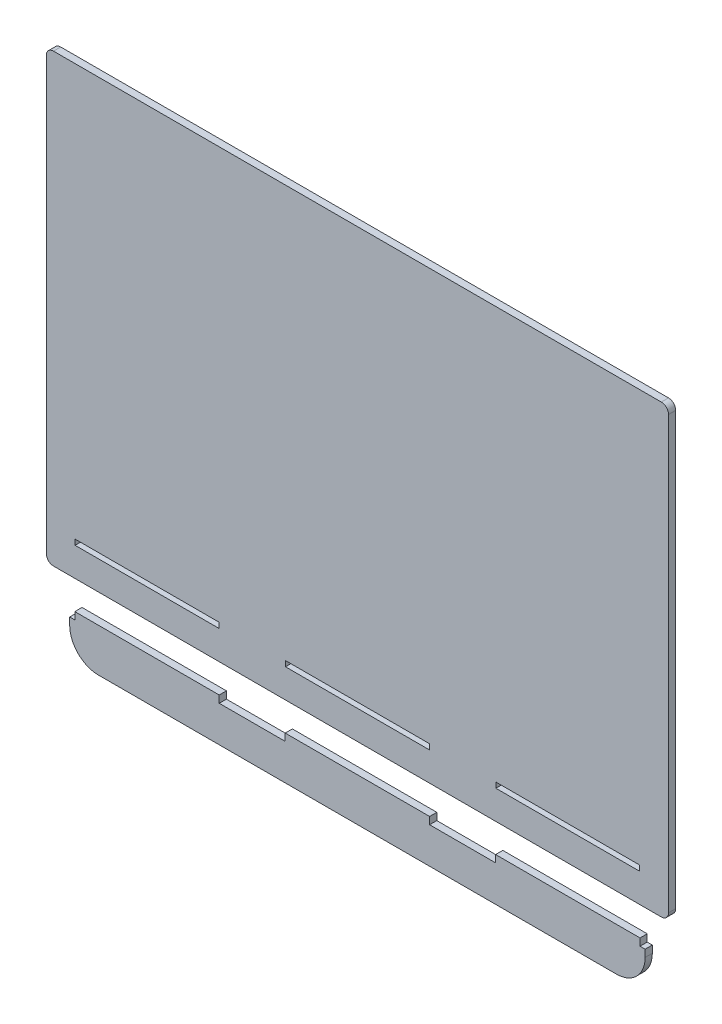
from build123d import *

# Parameters (mm, degrees)
BOSS_EXTRUDE1_DEPTH = 6.35
SKETCH2_W           = 127
SKETCH2_H           = 4.7625
CUT_EXTRUDE1_DEPTH  = 676.827668955
SKETCH3_W           = 508
SKETCH3_H           = 6.35
BOSS_EXTRUDE2_DEPTH = 38.1
SKETCH8_W           = 4.5085
SKETCH8_H           = 6.35
SKETCH8_W_2         = 58.2295
CUT_EXTRUDE2_DEPTH  = 676.827668955
FILLET1_R           = 25.4


with BuildPart() as part:
    # Sketch1 → Boss-Extrude1 (new body)
    with BuildSketch(Plane.XY):
        with BuildLine():
            Line((6.35, 0), (542.925, 0))
            ThreePointArc((542.925, 0), (547.415128061, 1.859871939), (549.275, 6.35))
            Line((549.275, 6.35), (549.275, 387.35))
            ThreePointArc((549.275, 387.35), (547.415128061, 391.840128061), (542.925, 393.7))
            Line((542.925, 393.7), (6.35, 393.7))
            ThreePointArc((6.35, 393.7), (1.859871939, 391.840128061), (0, 387.35))
            Line((0, 387.35), (0, 6.35))
            ThreePointArc((0, 6.35), (1.859871939, 1.859871939), (6.35, 0))
        make_face()
    extrude(amount=BOSS_EXTRUDE1_DEPTH)

    # Sketch2 → Cut-Extrude1 (cut, through all)
    with BuildSketch(Plane.XY.offset(6.35)):
        with Locations((460.375, 27.78125)):
            Rectangle(SKETCH2_W, SKETCH2_H)
        with Locations((274.6375, 27.78125)):
            Rectangle(SKETCH2_W, SKETCH2_H)
        with Locations((88.9, 27.78125)):
            Rectangle(SKETCH2_W, SKETCH2_H)
    extrude(amount=-CUT_EXTRUDE1_DEPTH, mode=Mode.SUBTRACT)


with BuildPart() as body_2:
    # Sketch3 → Boss-Extrude2 (new body)
    with BuildSketch(Plane.XZ.offset(25.4)):
        with Locations((274.6375, 3.175)):
            Rectangle(SKETCH3_W, SKETCH3_H)
    extrude(amount=BOSS_EXTRUDE2_DEPTH)

    # Sketch8 → Cut-Extrude2 (cut, through all)
    with BuildSketch(Plane.XY.offset(6.35)):
        with Locations((22.89175, -28.575)):
            Rectangle(SKETCH8_W, SKETCH8_H)
        with Locations((181.76875, -28.575)):
            Rectangle(SKETCH8_W_2, SKETCH8_H)
        with Locations((367.50625, -28.575)):
            Rectangle(SKETCH8_W_2, SKETCH8_H)
        with Locations((526.38325, -28.575)):
            Rectangle(SKETCH8_W, SKETCH8_H)
    extrude(amount=-CUT_EXTRUDE2_DEPTH, mode=Mode.SUBTRACT)

    # Fillet1
    fillet1_edges = [body_2.edges().sort_by_distance(p)[0] for p in [
        (20.6375, -63.5, 3.175),
        (528.6375, -63.5, 3.175),
    ]]
    fillet(fillet1_edges, radius=FILLET1_R)


solid = Compound([part.part, body_2.part])
